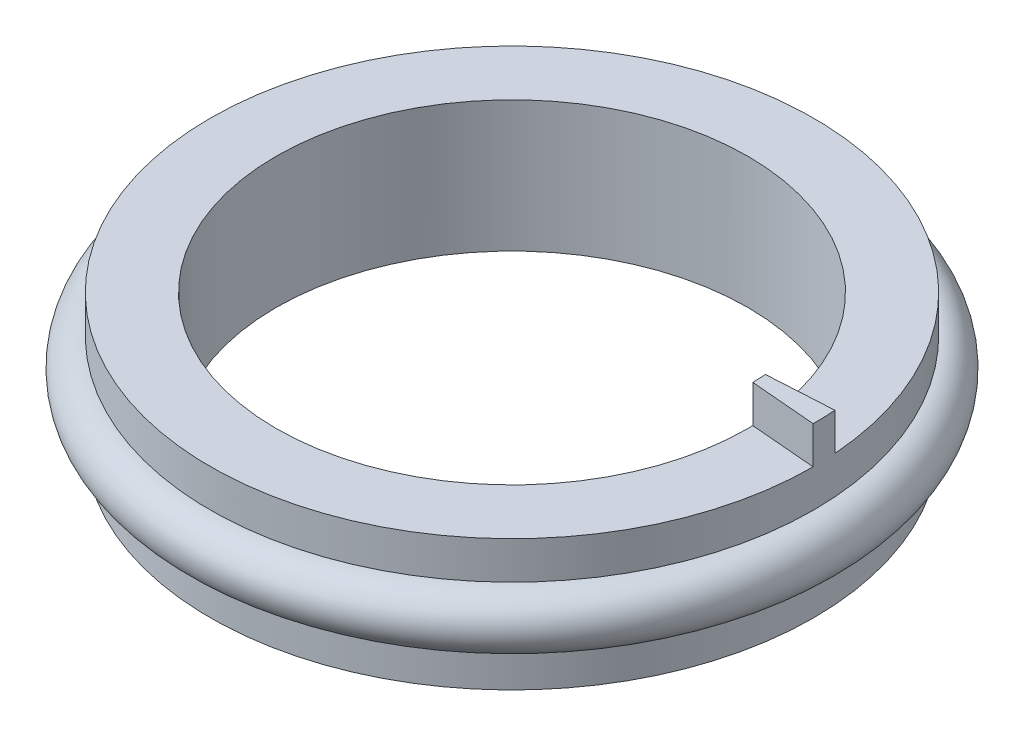
from build123d import *

# Parameters (mm, degrees)
BOSS_EXTRUDE1_DEPTH = 1


with BuildPart() as part:
    # Sketch1 → Revolve1 (revolve)
    with BuildSketch(Plane.XY):
        with BuildLine():
            Line((8.06, -0.352610192), (8.06, -1.359072581))
            Line((8.06, -1.359072581), (6.3, -1.359072581))
            Line((6.3, -1.359072581), (6.3, 2.140927419))
            Line((6.3, 2.140927419), (8.06, 2.140927419))
            Line((8.06, 2.140927419), (8.06, 1.13446503))
            ThreePointArc((8.06, 1.13446503), (8.803537611, 0.390927419), (8.06, -0.352610192))
        make_face()
    revolve(axis=Axis((0, -133.995441592, 0), (0, 1, 0)))

    # Sketch2 → Boss-Extrude1 (add)
    with BuildSketch(Plane(origin=(0, 2.140927419, 0), x_dir=(1, 0, 0), z_dir=(0, 1, 0))):
        with BuildLine():
            Line((6.298583041, 0.133610171), (8.059984934, -0.015584327))
            ThreePointArc((8.059984934, -0.015584327), (8.054947739, 0.285336502), (8.038679535, 0.585859486))
            Line((8.038679535, 0.585859486), (6.281305641, 0.484973654))
            ThreePointArc((6.281305641, 0.484973654), (6.292397308, 0.309412531), (6.298583041, 0.133610171))
        make_face()
    extrude(amount=BOSS_EXTRUDE1_DEPTH)


solid = part.part
